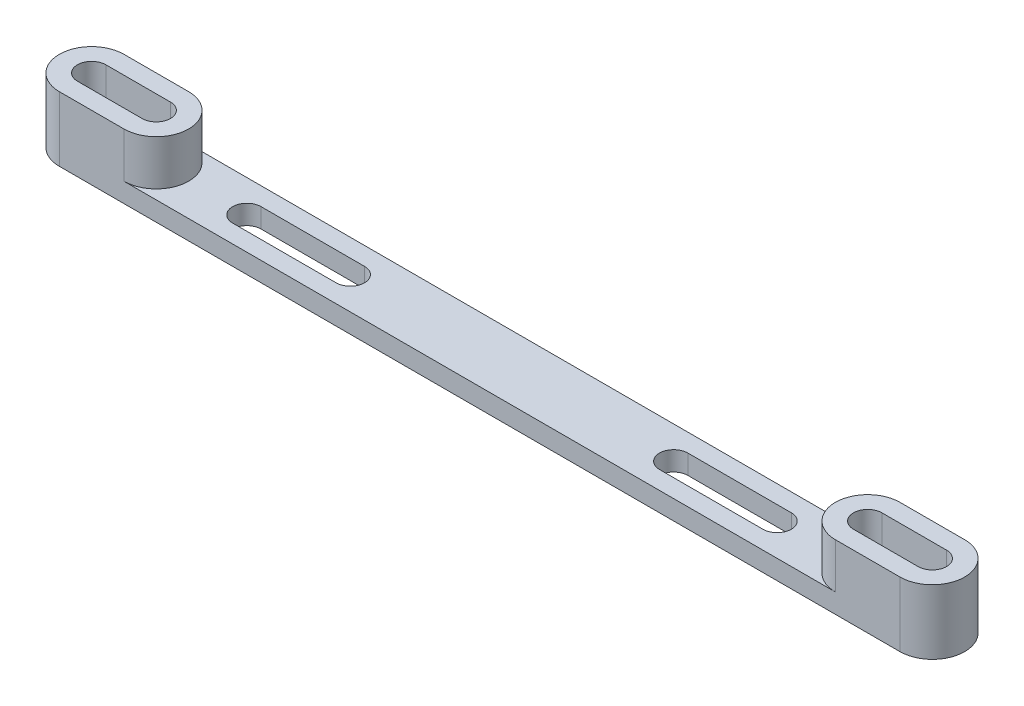
from build123d import *

# Parameters (mm, degrees)
EXTRUDE_1_DEPTH     = 3
EXTRUDE_2_DEPTH     = 7
CUT_EXTRUDE_1_DEPTH = 71.887234394
CUT_EXTRUDE_2_DEPTH = 71.52659073


with BuildPart() as part:
    # 草图1 → 凸台-拉伸1 (new body)
    with BuildSketch(Plane(origin=(0, 0, 0), x_dir=(1, 0, 0), z_dir=(0, 1, 0))):
        with BuildLine():
            Line((-65, 5), (65, 5))
            ThreePointArc((65, 5), (70, 0), (65, -5))
            Line((65, -5), (-65, -5))
            ThreePointArc((-65, -5), (-70, 0), (-65, 5))
        make_face()
    extrude(amount=EXTRUDE_1_DEPTH)

    # 草图2 → 凸台-拉伸2 (add)
    with BuildSketch(Plane(origin=(0, 3, 0), x_dir=(1, 0, 0), z_dir=(0, 1, 0))):
        with BuildLine():
            Line((-65, 5), (-55, 5))
            ThreePointArc((-55, 5), (-50, 0), (-55, -5))
            Line((-55, -5), (-65, -5))
            ThreePointArc((-65, -5), (-70, 0), (-65, 5))
        make_face()
        with BuildLine():
            Line((65, 5), (55, 5))
            ThreePointArc((55, 5), (50, 0), (55, -5))
            Line((55, -5), (65, -5))
            ThreePointArc((65, -5), (70, 0), (65, 5))
        make_face()
    extrude(amount=EXTRUDE_2_DEPTH)

    # 草图3 → 切除-拉伸1 (cut, through all)
    with BuildSketch(Plane(origin=(0, 10, 0), x_dir=(1, 0, 0), z_dir=(0, 1, 0))):
        with BuildLine():
            Line((-65, 2.2), (-55, 2.2))
            ThreePointArc((-55, 2.2), (-52.8, 0), (-55, -2.2))
            Line((-55, -2.2), (-65, -2.2))
            ThreePointArc((-65, -2.2), (-67.2, 0), (-65, 2.2))
        make_face()
        with BuildLine():
            Line((65, 2.2), (55, 2.2))
            ThreePointArc((55, 2.2), (52.8, 0), (55, -2.2))
            Line((55, -2.2), (65, -2.2))
            ThreePointArc((65, -2.2), (67.2, 0), (65, 2.2))
        make_face()
    extrude(amount=-CUT_EXTRUDE_1_DEPTH, mode=Mode.SUBTRACT)

    # 草图4 → 切除-拉伸2 (cut, through all)
    with BuildSketch(Plane(origin=(0, 3, 0), x_dir=(1, 0, 0), z_dir=(0, 1, 0))):
        with BuildLine():
            Line((-41, 2.2), (-25, 2.2))
            ThreePointArc((-25, 2.2), (-22.8, 0), (-25, -2.2))
            Line((-25, -2.2), (-41, -2.2))
            ThreePointArc((-41, -2.2), (-43.2, 0), (-41, 2.2))
        make_face()
        with BuildLine():
            Line((41, 2.2), (25, 2.2))
            ThreePointArc((25, 2.2), (22.8, 0), (25, -2.2))
            Line((25, -2.2), (41, -2.2))
            ThreePointArc((41, -2.2), (43.2, 0), (41, 2.2))
        make_face()
    extrude(amount=-CUT_EXTRUDE_2_DEPTH, mode=Mode.SUBTRACT)


solid = part.part
